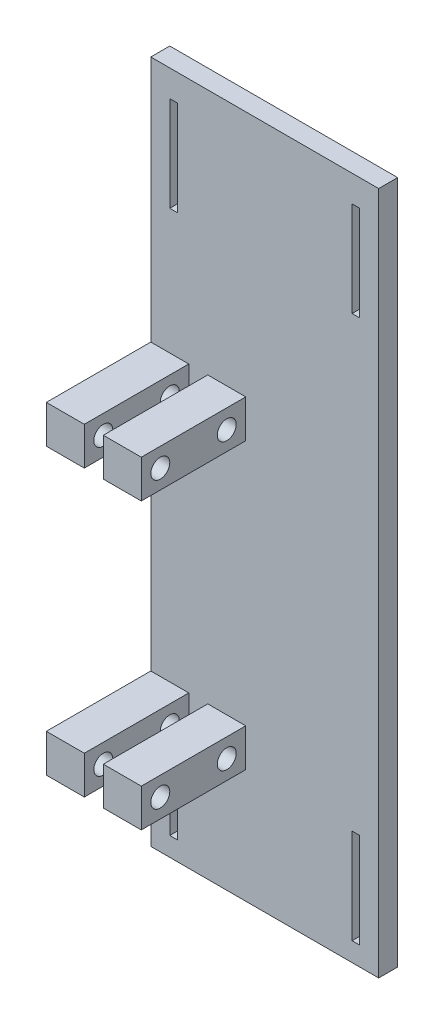
from build123d import *

# Parameters (mm, degrees)
CROQUIS1_W              = 60
CROQUIS1_H              = 170
SALIENTE_EXTRUIR1_DEPTH = 5
CROQUIS2_W              = 10
CROQUIS2_H              = 10
SALIENTE_EXTRUIR2_DEPTH = 27.5
CROQUIS3_R              = 2.5
CORTAR_EXTRUIR1_DEPTH   = 27.5
CROQUIS4_W              = 2
CROQUIS4_H              = 25
CORTAR_EXTRUIR2_DEPTH   = 27.5
CROQUIS6_W              = 60
CROQUIS6_H              = 5
SALIENTE_EXTRUIR3_DEPTH = 10
CROQUIS7_W              = 2
CROQUIS7_H              = 25
CORTAR_EXTRUIR3_DEPTH   = 10


with BuildPart() as part:
    # Croquis1 → Saliente-Extruir1 (new body)
    with BuildSketch(Plane.XY):
        with Locations((30, 85)):
            Rectangle(CROQUIS1_W, CROQUIS1_H)
    extrude(amount=SALIENTE_EXTRUIR1_DEPTH)

    # Croquis2 → Saliente-Extruir2 (add)
    with BuildSketch(Plane.XY.offset(5)):
        with Locations((20, 100)):
            Rectangle(CROQUIS2_W, CROQUIS2_H)
        with Locations((5, 100)):
            Rectangle(CROQUIS2_W, CROQUIS2_H)
        with Locations((20, 25)):
            Rectangle(CROQUIS2_W, CROQUIS2_H)
        with Locations((5, 25)):
            Rectangle(CROQUIS2_W, CROQUIS2_H)
    extrude(amount=SALIENTE_EXTRUIR2_DEPTH)

    # Croquis3 → Cortar-Extruir1 (cut)
    with BuildSketch(Plane(origin=(25, 0, 0), x_dir=(0, 0, -1), z_dir=(1, 0, 0))):
        with Locations((-27.5, 100)):
            Circle(CROQUIS3_R)
        with Locations((-10, 100)):
            Circle(CROQUIS3_R)
        with Locations((-27.5, 25)):
            Circle(CROQUIS3_R)
        with Locations((-10, 25)):
            Circle(CROQUIS3_R)
    extrude(amount=-CORTAR_EXTRUIR1_DEPTH, mode=Mode.SUBTRACT)

    # Croquis4 → Cortar-Extruir2 (cut)
    with BuildSketch(Plane.XY.offset(5)):
        with Locations((6, 150.5)):
            Rectangle(CROQUIS4_W, CROQUIS4_H)
        with Locations((54, 150.5)):
            Rectangle(CROQUIS4_W, CROQUIS4_H)
    extrude(amount=-CORTAR_EXTRUIR2_DEPTH, mode=Mode.SUBTRACT)

    # Croquis6 → Saliente-Extruir3 (add)
    with BuildSketch(Plane.XZ):
        with Locations((30, 2.5)):
            Rectangle(CROQUIS6_W, CROQUIS6_H)
    extrude(amount=SALIENTE_EXTRUIR3_DEPTH)

    # Croquis7 → Cortar-Extruir3 (cut)
    with BuildSketch(Plane.XY.offset(5)):
        with Locations((6, 7.5)):
            Rectangle(CROQUIS7_W, CROQUIS7_H)
        with Locations((54, 7.5)):
            Rectangle(CROQUIS7_W, CROQUIS7_H)
    extrude(amount=-CORTAR_EXTRUIR3_DEPTH, mode=Mode.SUBTRACT)


solid = part.part
